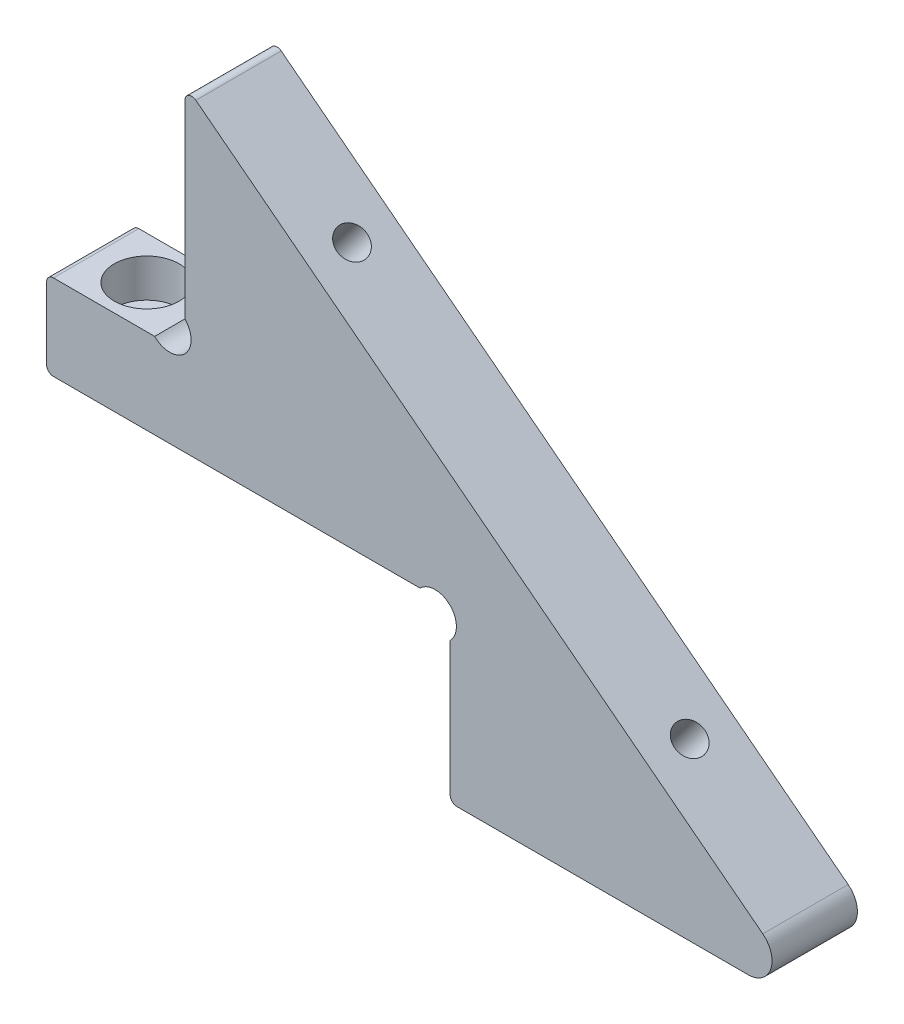
from build123d import *

# Parameters (mm, degrees)
BOSS_EXTRUDE1_DEPTH                            = 6.35
FILLET1_R                                      = 0.508
CBORE_FOR_4_SOCKET_HEAD_CAP_SCREW1_D           = 2.9464
CBORE_FOR_4_SOCKET_HEAD_CAP_SCREW1_CBORE_D     = 4.826
CBORE_FOR_4_SOCKET_HEAD_CAP_SCREW1_CBORE_DEPTH = 2.8448
TAP_DRILL_FOR_4_40_TAP1_D                      = 2.2606
TAP_DRILL_FOR_4_40_TAP1_DEPTH                  = 7.357911993
TAP_DRILL_FOR_4_40_TAP1_TIP                    = 0.679152758
TAP_DRILL_FOR_4_40_TAP2_D                      = 2.2606
TAP_DRILL_FOR_4_40_TAP2_DEPTH                  = 8.235563733
TAP_DRILL_FOR_4_40_TAP2_TIP                    = 0.679152758


with BuildPart() as part:
    # Model → Boss-Extrude1 (new body)
    with BuildSketch(Plane.XY):
        with BuildLine():
            Line((-662.928291328, 76.124043703), (-690.700357042, 76.124043703))
            Line((-690.700357042, 76.124043703), (-690.700357042, 82.474043703))
            Line((-690.700357042, 82.474043703), (-682.661678057, 82.474043703))
            ThreePointArc((-682.661678057, 82.474043703), (-680.416614026, 82.474043703), (-680.416614026, 84.719107734))
            Line((-680.416614026, 84.719107734), (-680.416614026, 99.844571929))
            Line((-680.416614026, 99.844571929), (-637.431275221, 66.6046705))
            ThreePointArc((-637.431275221, 66.6046705), (-636.837083068, 64.625922801), (-638.517578145, 63.42407295))
            Line((-638.517578145, 63.42407295), (-660.683227297, 63.42407295))
            Line((-660.683227297, 63.42407295), (-660.683227297, 73.878979673))
            ThreePointArc((-660.683227297, 73.878979673), (-660.683227297, 76.124043703), (-662.928291328, 76.124043703))
        make_face()
    extrude(amount=BOSS_EXTRUDE1_DEPTH)

    # Fillet1
    fillet1_edges = [part.edges().sort_by_distance(p)[0] for p in [
        (-690.700357042, 76.124043703, 3.175),
        (-690.700357042, 82.474043703, 3.175),
        (-680.416614026, 99.844571929, 3.175),
        (-660.683227297, 63.42407295, 3.175),
    ]]
    fillet(fillet1_edges, radius=FILLET1_R)

    # CBORE for #4 Socket Head Cap Screw1 (through all)
    with Locations(Plane(origin=(0, 82.474043703, 0), x_dir=(1, 0, 0), z_dir=(0, 1, 0))):
        with Locations((-686.427017549, -3.175)):
            CounterBoreHole(CBORE_FOR_4_SOCKET_HEAD_CAP_SCREW1_D / 2, CBORE_FOR_4_SOCKET_HEAD_CAP_SCREW1_CBORE_D / 2, CBORE_FOR_4_SOCKET_HEAD_CAP_SCREW1_CBORE_DEPTH)

    # Tap Drill for #4-40 Tap1
    with Locations(Plane(origin=(-206.299258714, -266.783087499, 0), x_dir=(0.7910716317479708, -0.6117235269659022, 0), z_dir=(0.6117235269659022, 0.7910716317479708, 0))):
        with Locations((-555.88255935, -3.175)):
            Hole(TAP_DRILL_FOR_4_40_TAP1_D / 2, depth=TAP_DRILL_FOR_4_40_TAP1_DEPTH)
            with Locations((0, 0, -(TAP_DRILL_FOR_4_40_TAP1_DEPTH + TAP_DRILL_FOR_4_40_TAP1_TIP / 2))):  # 118° drill point
                Cone(0, TAP_DRILL_FOR_4_40_TAP1_D / 2, TAP_DRILL_FOR_4_40_TAP1_TIP, mode=Mode.SUBTRACT)

    # Tap Drill for #4-40 Tap2
    with Locations(Plane(origin=(-206.299258714, -266.783087499, 0), x_dir=(0.7910716317479708, -0.6117235269659022, 0), z_dir=(0.6117235269659022, 0.7910716317479708, 0))):
        with Locations((-587.63255935, -3.175)):
            Hole(TAP_DRILL_FOR_4_40_TAP2_D / 2, depth=TAP_DRILL_FOR_4_40_TAP2_DEPTH)
            with Locations((0, 0, -(TAP_DRILL_FOR_4_40_TAP2_DEPTH + TAP_DRILL_FOR_4_40_TAP2_TIP / 2))):  # 118° drill point
                Cone(0, TAP_DRILL_FOR_4_40_TAP2_D / 2, TAP_DRILL_FOR_4_40_TAP2_TIP, mode=Mode.SUBTRACT)


solid = part.part
